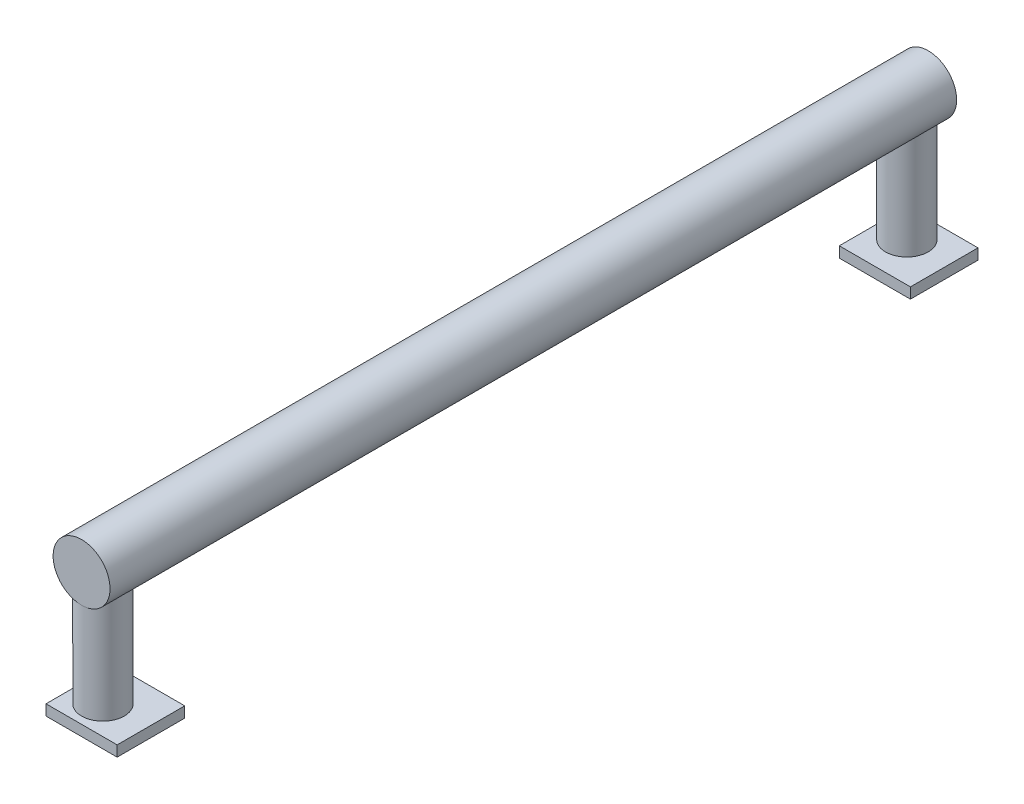
from build123d import *

# Parameters (mm, degrees)
SK_P01_FOOT_W  = 20
SK_P01_FOOT_H  = 19
P01_FOOT_DEPTH = 3
SK_P02_FOOT_W  = 20
SK_P02_FOOT_H  = 19
P02_FOOT_DEPTH = 3
P03_LEG_START  = 3
SK_P03_LEG_R   = 6
P03_LEG_DEPTH  = 35
P04_LEG_START  = 3
SK_P04_LEG_R   = 6
P04_LEG_DEPTH  = 35
P05_GRIP_START = -119
SK_P05_GRIP_R  = 8
P05_GRIP_DEPTH = 238


with BuildPart() as part:
    # SK_P01_Foot → P01_Foot (new body)
    with BuildSketch(Plane(origin=(0, 0, 0), x_dir=(1, 0, 0), z_dir=(0, 1, 0))):
        with Locations((0, -111.5)):
            Rectangle(SK_P01_FOOT_W, SK_P01_FOOT_H)
    extrude(amount=P01_FOOT_DEPTH)

    # SK_P03_Leg → P03_Leg (add)
    with BuildSketch(Plane(origin=(0, 0, 0), x_dir=(1, 0, 0), z_dir=(0, 1, 0)).offset(P03_LEG_START)):
        with Locations(Location((-2, -113, 0), (0, 0, 270))):
            Circle(SK_P03_LEG_R)
    extrude(amount=P03_LEG_DEPTH)



with BuildPart() as body_2:
    # SK_P02_Foot → P02_Foot (new body)
    with BuildSketch(Plane(origin=(0, 0, 0), x_dir=(1, 0, 0), z_dir=(0, 1, 0))):
        with Locations((0, 111.5)):
            Rectangle(SK_P02_FOOT_W, SK_P02_FOOT_H)
    extrude(amount=P02_FOOT_DEPTH)

    # SK_P04_Leg → P04_Leg (add)
    with BuildSketch(Plane(origin=(0, 0, 0), x_dir=(1, 0, 0), z_dir=(0, 1, 0)).offset(P04_LEG_START)):
        with Locations(Location((-2, 113, 0), (0, 0, 270))):
            Circle(SK_P04_LEG_R)
    extrude(amount=P04_LEG_DEPTH)


with BuildPart() as part_1:
    add(part.part)

    add(body_2.part)  # P05_Grip merges body 2
    # SK_P05_Grip → P05_Grip (add)
    with BuildSketch(Plane.XY.offset(P05_GRIP_START)):
        with Locations(Location((-2, 38, 0), (0, 0, 270))):
            Circle(SK_P05_GRIP_R)
    extrude(amount=P05_GRIP_DEPTH)


solid = part_1.part
